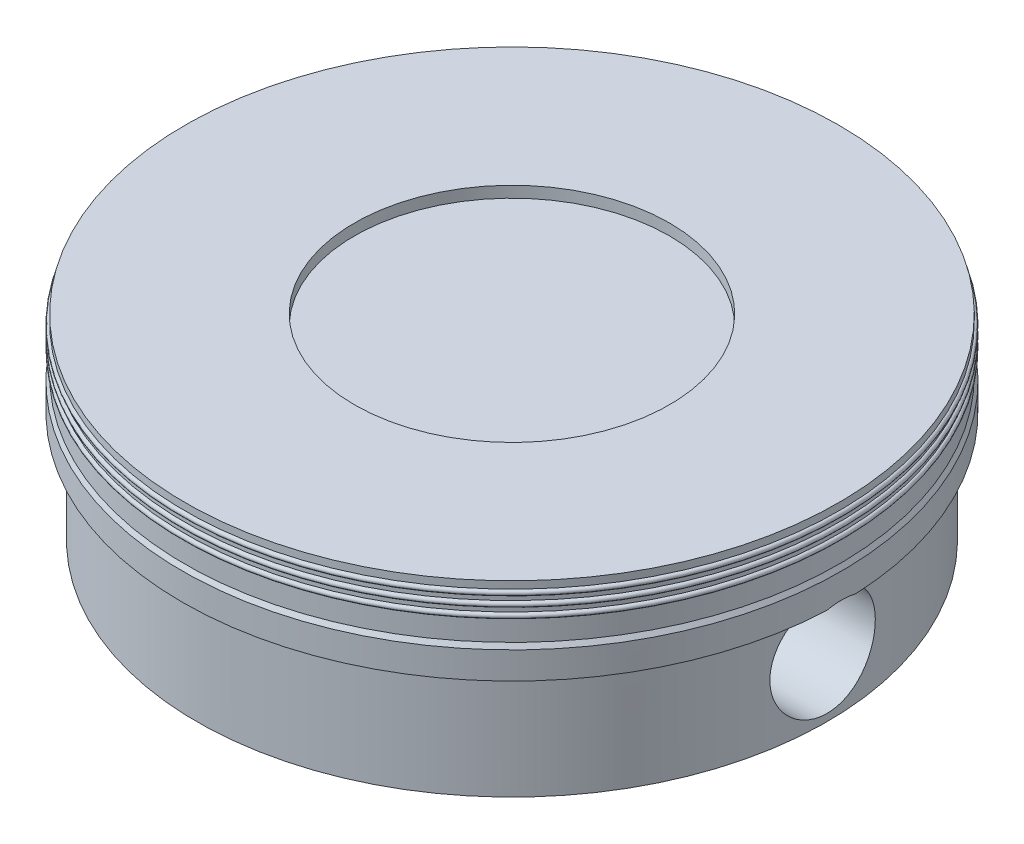
from build123d import *

# Parameters (mm, degrees)
BOSS_EXTRUDE1_REACH     = 9.669
CUT_EXTRUDE1_DEPTH      = 8.6694786
CUT_EXTRUDE1_DEPTH_BACK = 8.6694786
SKETCH3_R               = 0.8


with BuildPart() as part:
    # Sketch1 → Revolve1 (revolve)
    with BuildSketch(Plane.XY, mode=Mode.PRIVATE) as revolve1_sk:
        with BuildLine():
            Line((3.43, 1.93), (4.2, 1.93))
            Line((4.2, 1.93), (4.2, 2.33))
            Line((4.2, 2.33), (0, 2.33))
            Line((0, 2.33), (0, 2.8))
            Line((0, 2.8), (2.39, 2.8))
            Line((2.39, 2.8), (2.39, 2.97))
            Line((2.39, 2.97), (4.96, 2.97))
            Line((4.96, 2.97), (4.96, 2.86))
            ThreePointArc((4.96, 2.86), (5, 2.82), (4.96, 2.78))
            Line((4.96, 2.78), (4.96, 2.71))
            ThreePointArc((4.96, 2.71), (5, 2.67), (4.96, 2.63))
            Line((4.96, 2.63), (4.96, 2.56))
            ThreePointArc((4.96, 2.56), (5, 2.52), (4.96, 2.48))
            Line((4.96, 2.48), (4.96, 2.16))
            Line((4.96, 2.16), (5, 2.09))
            Line((5, 2.09), (5, 1.68))
            Line((5, 1.68), (4.78, 1.68))
            Line((4.78, 1.68), (4.78, 0))
            Line((4.78, 0), (3.43, 0))
            Line((3.43, 0), (3.43, 1.93))
        make_face()
    revolve(revolve1_sk.sketch.rotate(Axis((0, 0, 0), (0, 1, 0)), 90), axis=Axis((0, 0, 0), (0, 1, 0)))

    # Sketch2 → Boss-Extrude1 (add, up to next)
    with BuildSketch(Plane.XZ, mode=Mode.PRIVATE) as boss_extrude1_sk1:
        with BuildLine():
            Line((-1.75, 2.949983051), (-1.75, -2.949983051))
            ThreePointArc((-1.75, -2.949983051), (-3.43, 0), (-1.75, 2.949983051))
        make_face()
    boss_extrude1_tool1 = extrude(boss_extrude1_sk1.sketch, amount=-BOSS_EXTRUDE1_REACH, mode=Mode.PRIVATE) - part.part
    # Sketch2 → Boss-Extrude1 (add, up to next)
    with BuildSketch(Plane.XZ, mode=Mode.PRIVATE) as boss_extrude1_sk2:
        with BuildLine():
            Line((1.75, 2.949983051), (1.75, -2.949983051))
            ThreePointArc((1.75, -2.949983051), (3.43, 0), (1.75, 2.949983051))
        make_face()
    boss_extrude1_tool2 = extrude(boss_extrude1_sk2.sketch, amount=-BOSS_EXTRUDE1_REACH, mode=Mode.PRIVATE) - part.part
    add(boss_extrude1_tool1.solids().sort_by_distance((-2.438465, 0, 0))[0])
    add(boss_extrude1_tool2.solids().sort_by_distance((2.438465, 0, 0))[0])

    # Sketch3 → Cut-Extrude1 (cut, two sides: drawn at the far end of the back side and taken through both)
    with BuildSketch(Plane(origin=(0, 0, 0), x_dir=(0, 0, -1), z_dir=(1, 0, 0)).offset(-CUT_EXTRUDE1_DEPTH_BACK)):
        with Locations(Location((0, 0.91, 0), (0, 0, 74.259451475))):
            Circle(SKETCH3_R)
    extrude(amount=CUT_EXTRUDE1_DEPTH + CUT_EXTRUDE1_DEPTH_BACK, mode=Mode.SUBTRACT)


solid = part.part
